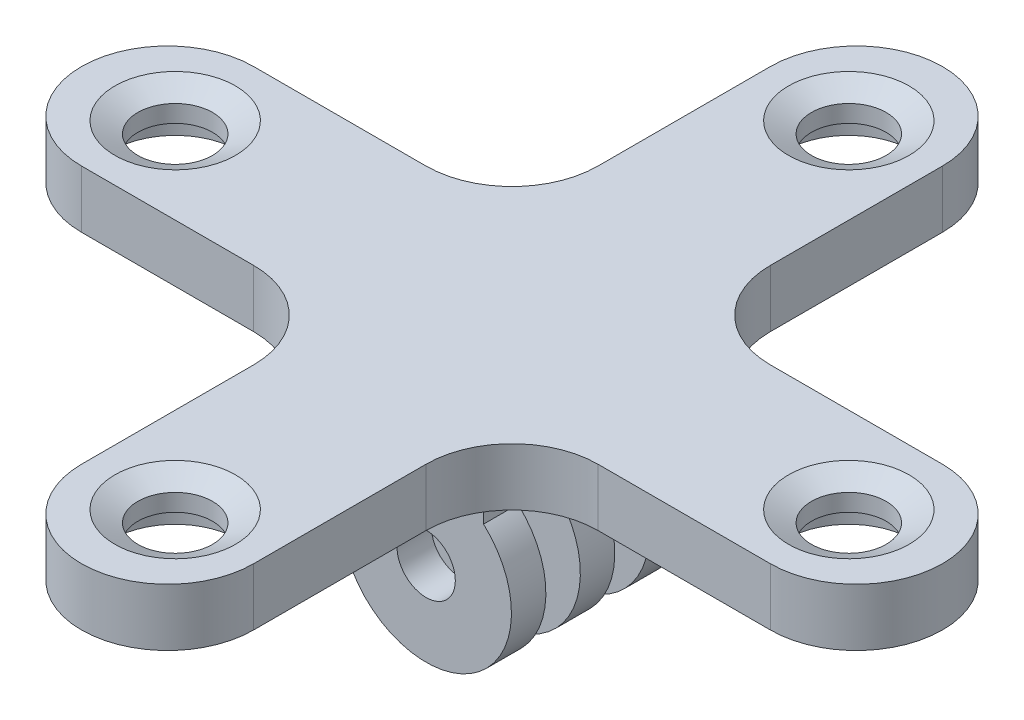
from build123d import *

# Parameters (mm, degrees)
ESTRUSIONE_ESTRUSIONE1_DEPTH = 5
SCHIZZO4_R                   = 3.25
TAGLIO_ESTRUSIONE1_DEPTH     = 64.748958347
SMUSSO2_SIZE                 = 2
SMUSSO2_SIZE2                = 1
SCHIZZO5_R                   = 5.5
TAGLIO_ESTRUSIONE2_DEPTH     = 2.5
SCHIZZO7_R                   = 2.54
ESTRUSIONE_ESTRUSIONE2_DEPTH = 20
SCHIZZO9_W                   = 20
SCHIZZO9_H                   = 3
SCHIZZO9_H_2                 = 4.712842408
SCHIZZO9_H_3                 = 4.145579672
TAGLIO_ESTRUSIONE3_DEPTH     = 20


with BuildPart() as part:
    # Schizzo3 → Estrusione-Estrusione1 (new body)
    with BuildSketch(Plane(origin=(0, 0, 0), x_dir=(1, 0, 0), z_dir=(0, 1, 0))):
        with BuildLine():
            Line((-25.964231013, 18.101035176), (-10.964231013, 18.101035176))
            ThreePointArc((-10.964231013, 18.101035176), (-5.660930154, 20.297734317), (-3.464231013, 25.601035176))
            Line((-3.464231013, 25.601035176), (-3.464231013, 40.601035176))
            ThreePointArc((-3.464231013, 40.601035176), (4.035768987, 48.101035176), (11.535768987, 40.601035176))
            Line((11.535768987, 40.601035176), (11.535768987, 25.601035176))
            ThreePointArc((11.535768987, 25.601035176), (13.732468128, 20.297734317), (19.035768987, 18.101035176))
            Line((19.035768987, 18.101035176), (34.035768987, 18.101035176))
            ThreePointArc((34.035768987, 18.101035176), (41.535768987, 10.601035176), (34.035768987, 3.101035176))
            Line((34.035768987, 3.101035176), (19.035768987, 3.101035176))
            ThreePointArc((19.035768987, 3.101035176), (13.732468128, 0.904336035), (11.535768987, -4.398964824))
            Line((11.535768987, -4.398964824), (11.535768987, -19.398964824))
            ThreePointArc((11.535768987, -19.398964824), (4.035768987, -26.898964824), (-3.464231013, -19.398964824))
            Line((-3.464231013, -19.398964824), (-3.464231013, -4.398964824))
            ThreePointArc((-3.464231013, -4.398964824), (-5.660930154, 0.904336035), (-10.964231013, 3.101035176))
            Line((-10.964231013, 3.101035176), (-25.964231013, 3.101035176))
            ThreePointArc((-25.964231013, 3.101035176), (-33.464231013, 10.601035176), (-25.964231013, 18.101035176))
        make_face()
    extrude(amount=ESTRUSIONE_ESTRUSIONE1_DEPTH)

    # Schizzo4 → Taglio-Estrusione1 (cut, through all)
    with BuildSketch(Plane(origin=(0, 5, 0), x_dir=(1, 0, 0), z_dir=(0, 1, 0))):
        with Locations(Location((4.035768987, -18.733964824, 0), (0, 0, 270))):
            Circle(SCHIZZO4_R)
        with Locations(Location((4.035768987, 39.936035176, 0), (0, 0, 270))):
            Circle(SCHIZZO4_R)
        with Locations(Location((-25.299231013, 10.601035176, 0), (0, 0, 270))):
            Circle(SCHIZZO4_R)
        with Locations(Location((33.370768987, 10.601035176, 0), (0, 0, 270))):
            Circle(SCHIZZO4_R)
    extrude(amount=-TAGLIO_ESTRUSIONE1_DEPTH, mode=Mode.SUBTRACT)

    # Smusso2
    smusso2_edges = [part.edges().sort_by_distance(p)[0] for p in [
        (4.035768987, 5, 15.483964824),
        (4.035768987, 5, -43.186035176),
        (-25.299231013, 5, -13.851035176),
        (33.370768987, 5, -13.851035176),
    ]]
    smusso2_side = [part.faces().sort_by_distance(p)[0] for p in [
        (4.035768987, 5, -10.601035176),
    ]]
    chamfer(smusso2_edges, length=SMUSSO2_SIZE, length2=SMUSSO2_SIZE2, reference=smusso2_side[0])

    # Schizzo5 → Taglio-Estrusione2 (cut)
    with BuildSketch(Plane.XZ):
        with Locations(Location((4.03661079, 18.733616138, 0), (0, 0, 270))):
            Circle(SCHIZZO5_R)
        with Locations(Location((4.03661079, -39.936383862, 0), (0, 0, 270))):
            Circle(SCHIZZO5_R)
        with Locations(Location((-25.29838921, -10.601383862, 0), (0, 0, 270))):
            Circle(SCHIZZO5_R)
        with Locations(Location((33.370420301, -10.600193374, 0), (0, 0, 270))):
            Circle(SCHIZZO5_R)
    extrude(amount=-TAGLIO_ESTRUSIONE2_DEPTH, mode=Mode.SUBTRACT)

    # Schizzo7 → Estrusione-Estrusione2 (add)
    with BuildSketch(Plane.XY):
        with BuildLine():
            Line((-0.941517405, -4.504101529), (-0.941517405, 0))
            Line((-0.941517405, 0), (9.058482595, 0))
            Line((9.058482595, 0), (9.058482595, -4.504101529))
            ThreePointArc((9.058482595, -4.504101529), (4.058482595, -17.43), (-0.941517405, -4.504101529))
        make_face()
        with Locations((4.058482595, -10)):
            Circle(SCHIZZO7_R, mode=Mode.SUBTRACT)
    extrude(amount=-ESTRUSIONE_ESTRUSIONE2_DEPTH)

    # Schizzo9 → Taglio-Estrusione3 (cut)
    with BuildSketch(Plane.XZ):
        with Locations((4.109140738, -7.601035176)):
            Rectangle(SCHIZZO9_W, SCHIZZO9_H)
        with Locations((4.109140738, -13.601035176)):
            Rectangle(SCHIZZO9_W, SCHIZZO9_H)
        with Locations((4.109140738, -0.744613972)):
            Rectangle(SCHIZZO9_W, SCHIZZO9_H_2)
        with Locations((4.109140738, -20.173825012)):
            Rectangle(SCHIZZO9_W, SCHIZZO9_H_3)
    extrude(amount=TAGLIO_ESTRUSIONE3_DEPTH, mode=Mode.SUBTRACT)


solid = part.part
